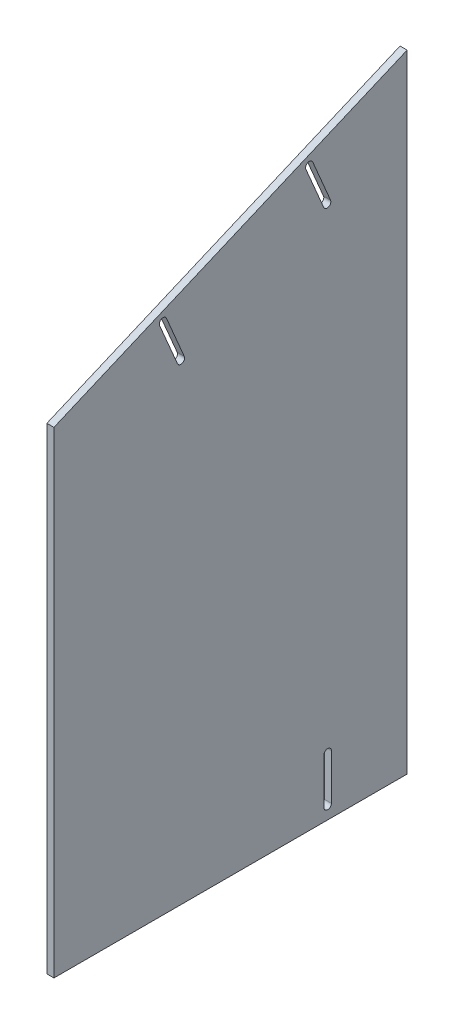
from build123d import *

# Parameters (mm, degrees)
BOSS_EXTRUDE1_DEPTH = 4


with BuildPart() as part:
    # Sketch1 → Boss-Extrude1 (new body)
    with BuildSketch(Plane.YZ):
        Polygon((-85, 200), (0, 0), (-355, 0), (-355, 200), align=None)
        with BuildLine():
            Line((-322.1, 47.1), (-347.9, 47.1))
            ThreePointArc((-347.9, 47.1), (-350, 45), (-347.9, 42.9))
            Line((-347.9, 42.9), (-322.1, 42.9))
            ThreePointArc((-322.1, 42.9), (-320, 45), (-322.1, 47.1))
        make_face(mode=Mode.SUBTRACT)
        with BuildLine():
            Line((-64.998908315, 140.155482027), (-88.743446011, 130.064053506))
            ThreePointArc((-88.743446011, 130.064053506), (-89.854745595, 127.309963233), (-87.100655321, 126.198663649))
            Line((-87.100655321, 126.198663649), (-63.356117625, 136.29009217))
            ThreePointArc((-63.356117625, 136.29009217), (-62.244818041, 139.044182443), (-64.998908315, 140.155482027))
        make_face(mode=Mode.SUBTRACT)
        with BuildLine():
            Line((-28.153459994, 53.460309508), (-51.89799769, 43.368880988))
            ThreePointArc((-51.89799769, 43.368880988), (-54.652087964, 44.480180572), (-53.54078838, 47.234270845))
            Line((-53.54078838, 47.234270845), (-29.796250684, 57.325699366))
            ThreePointArc((-29.796250684, 57.325699366), (-27.04216041, 56.214399782), (-28.153459994, 53.460309508))
        make_face(mode=Mode.SUBTRACT)
    extrude(amount=BOSS_EXTRUDE1_DEPTH)


solid = part.part
